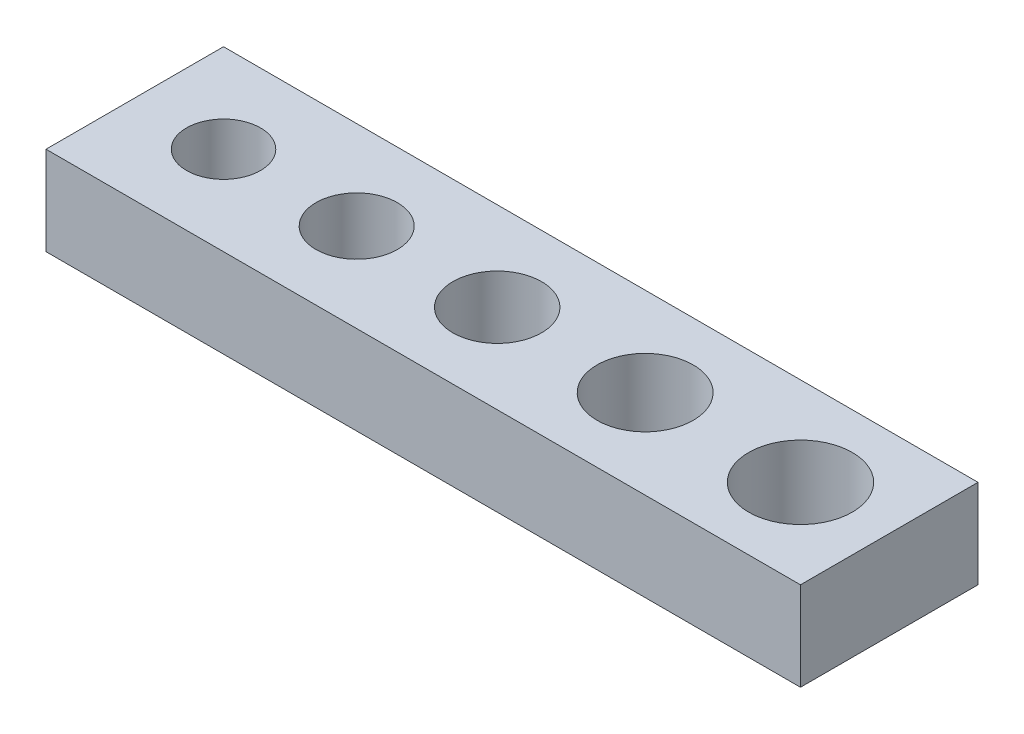
from build123d import *

# Parameters (mm, degrees)
SKETCH1_W           = 25.5
SKETCH1_H           = 6
SKETCH1_R           = 1.25
SKETCH1_R_2         = 1.5
SKETCH1_R_3         = 1.625
SKETCH1_R_4         = 1.375
SKETCH1_R_5         = 1.75
BOSS_EXTRUDE1_DEPTH = 3


with BuildPart() as part:
    # Sketch1 → Boss-Extrude1 (new body)
    with BuildSketch(Plane(origin=(0, 0, 0), x_dir=(1, 0, 0), z_dir=(0, 1, 0))):
        with Locations((-9.75, 0)):
            Rectangle(SKETCH1_W, SKETCH1_H)
        with Locations(Location((-19.5, 0, 0), (0, 0, 270))):
            Circle(SKETCH1_R, mode=Mode.SUBTRACT)
        with Locations(Location((-10.25, 0, 0), (0, 0, 270))):
            Circle(SKETCH1_R_2, mode=Mode.SUBTRACT)
        with Locations(Location((-5.25, 0, 0), (0, 0, 270))):
            Circle(SKETCH1_R_3, mode=Mode.SUBTRACT)
        with Locations(Location((-15, 0, 0), (0, 0, 270))):
            Circle(SKETCH1_R_4, mode=Mode.SUBTRACT)
        with Locations(Location((0, 0, 0), (0, 0, 270))):
            Circle(SKETCH1_R_5, mode=Mode.SUBTRACT)
    extrude(amount=BOSS_EXTRUDE1_DEPTH)


solid = part.part
